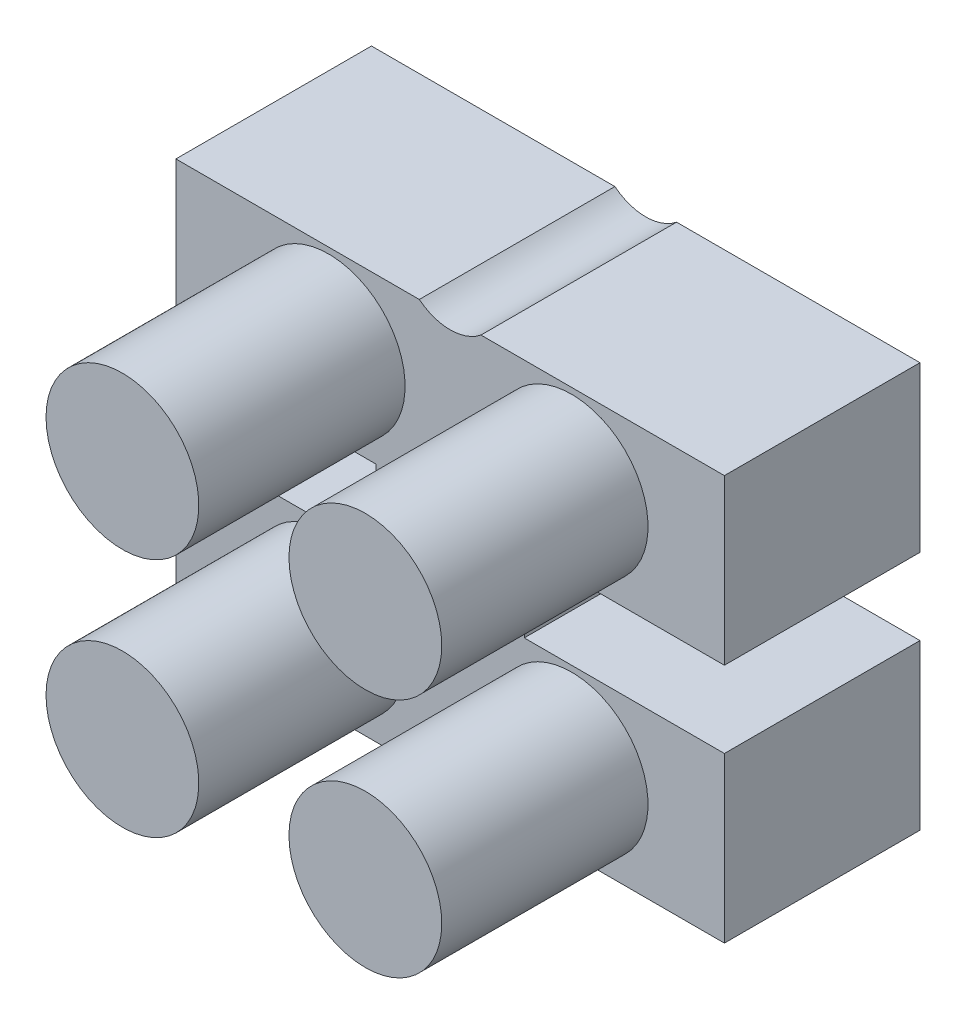
from build123d import *

# Parameters (mm, degrees)
SKETCH1_W                 = 18.2372
SKETCH1_H                 = 13.4874
BOSS_EXTRUDE1_DEPTH       = 6.5024
SKETCH2_W                 = 6.6548
SKETCH2_H                 = 2.54
CUT_EXTRUDE1_DEPTH        = 14.073161875
SKETCH5_R                 = 2.54
BOSS_EXTRUDE2_DEPTH       = 6.858
SKETCH6_W                 = 18.2372
SKETCH6_H                 = 5.4737
CUT_EXTRUDE2_DEPTH        = 14.253622888
F_4_CLEARANCE_HOLE1_D     = 3.2639
LPATTERN1_COUNT           = 4
LPATTERN1_PITCH           = 8.001
LPATTERN1_COPY_1_SKETCH_W = 6.6548
LPATTERN1_COPY_1_SKETCH_H = 2.54
LPATTERN1_COPY_1_DEPTH    = 14.073161875
LPATTERN1_COPY_2_SKETCH_W = 6.6548
LPATTERN1_COPY_2_SKETCH_H = 2.54
LPATTERN1_COPY_2_DEPTH    = 14.073161875
LPATTERN1_COPY_3_SKETCH_W = 6.6548
LPATTERN1_COPY_3_SKETCH_H = 2.54
LPATTERN1_COPY_3_DEPTH    = 14.073161875
LPATTERN1_COPY_4_SKETCH_R = 2.54
LPATTERN1_COPY_4_DEPTH    = 6.858
LPATTERN1_COPY_5_SKETCH_R = 2.54
LPATTERN1_COPY_5_DEPTH    = 6.858
LPATTERN1_COPY_6_SKETCH_R = 2.54
LPATTERN1_COPY_6_DEPTH    = 6.858
SKETCH7_W                 = 18.2372
SKETCH7_H                 = 8.0137
CUT_EXTRUDE3_DEPTH        = 33.795435519
SKETCH8_W                 = 18.2372
SKETCH8_H                 = 16.0147
CUT_EXTRUDE5_DEPTH        = 28.900509729


with BuildPart() as part:
    # Sketch1 → Boss-Extrude1 (new body)
    with BuildSketch(Plane.XY):
        Rectangle(SKETCH1_W, SKETCH1_H)
    boss_extrude1 = extrude(amount=BOSS_EXTRUDE1_DEPTH)

    # Sketch2 → Cut-Extrude1 (cut, through all)
    with BuildSketch(Plane.XY.offset(6.5024)):
        with Locations((5.7912, 0)):
            Rectangle(SKETCH2_W, SKETCH2_H)
    cut_extrude1 = extrude(amount=-CUT_EXTRUDE1_DEPTH, mode=Mode.SUBTRACT)

    # Sketch5 → Boss-Extrude2 (add)
    with BuildSketch(Plane.XY.offset(6.5024)):
        with Locations(Location((4.0386, -4.00685, 0), (0, 0, 180))):
            Circle(SKETCH5_R)
    boss_extrude2 = extrude(amount=BOSS_EXTRUDE2_DEPTH)

    # Sketch6 → Cut-Extrude2 (cut, through all)
    with BuildSketch(Plane.XY.offset(6.5024)):
        with Locations((0, 4.00685)):
            Rectangle(SKETCH6_W, SKETCH6_H)
    extrude(amount=-CUT_EXTRUDE2_DEPTH, mode=Mode.SUBTRACT)

    # #4 Clearance Hole1 (through all)
    with Locations(Plane.XY.offset(6.5024)):
        with Locations((0, 0)):
            f_4_clearance_hole1 = Hole(F_4_CLEARANCE_HOLE1_D / 2)

    # Mirror4: Cut-Extrude1, Boss-Extrude2 across plane
    add(cut_extrude1.mirror(Plane(origin=(0, 0, 0), x_dir=(0, 0, 1), z_dir=(1, 0, 0))), mode=Mode.SUBTRACT)
    add(boss_extrude2.mirror(Plane(origin=(0, 0, 0), x_dir=(0, 0, 1), z_dir=(1, 0, 0))))

    # LPattern1: Boss-Extrude1, Cut-Extrude1, Boss-Extrude2, #4 Clearance Hole1 ×4
    with Locations(*[(0, i * LPATTERN1_PITCH, 0) for i in range(1, LPATTERN1_COUNT)]):
        add(boss_extrude1)
        add(cut_extrude1, mode=Mode.SUBTRACT)
        add(boss_extrude2)
        add(f_4_clearance_hole1, mode=Mode.SUBTRACT)

    # LPattern1 copy 1 sketch → LPattern1 copy 1 (cut, through all)
    with BuildSketch(Plane(origin=(0, 8.001, 6.5024), x_dir=(-1, 0, 0), z_dir=(0, 0, 1))):
        with Locations((5.7912, 0)):
            Rectangle(LPATTERN1_COPY_1_SKETCH_W, LPATTERN1_COPY_1_SKETCH_H)
    extrude(amount=-LPATTERN1_COPY_1_DEPTH, mode=Mode.SUBTRACT)

    # LPattern1 copy 2 sketch → LPattern1 copy 2 (cut, through all)
    with BuildSketch(Plane(origin=(0, 16.002, 6.5024), x_dir=(-1, 0, 0), z_dir=(0, 0, 1))):
        with Locations((5.7912, 0)):
            Rectangle(LPATTERN1_COPY_2_SKETCH_W, LPATTERN1_COPY_2_SKETCH_H)
    extrude(amount=-LPATTERN1_COPY_2_DEPTH, mode=Mode.SUBTRACT)

    # LPattern1 copy 3 sketch → LPattern1 copy 3 (cut, through all)
    with BuildSketch(Plane(origin=(0, 24.003, 6.5024), x_dir=(-1, 0, 0), z_dir=(0, 0, 1))):
        with Locations((5.7912, 0)):
            Rectangle(LPATTERN1_COPY_3_SKETCH_W, LPATTERN1_COPY_3_SKETCH_H)
    extrude(amount=-LPATTERN1_COPY_3_DEPTH, mode=Mode.SUBTRACT)

    # LPattern1 copy 4 sketch → LPattern1 copy 4 (add)
    with BuildSketch(Plane(origin=(0, 8.001, 6.5024), x_dir=(-1, 0, 0), z_dir=(0, 0, 1))):
        with Locations((4.0386, 4.00685)):
            Circle(LPATTERN1_COPY_4_SKETCH_R)
    extrude(amount=LPATTERN1_COPY_4_DEPTH)

    # LPattern1 copy 5 sketch → LPattern1 copy 5 (add)
    with BuildSketch(Plane(origin=(0, 16.002, 6.5024), x_dir=(-1, 0, 0), z_dir=(0, 0, 1))):
        with Locations((4.0386, 4.00685)):
            Circle(LPATTERN1_COPY_5_SKETCH_R)
    extrude(amount=LPATTERN1_COPY_5_DEPTH)

    # LPattern1 copy 6 sketch → LPattern1 copy 6 (add)
    with BuildSketch(Plane(origin=(0, 24.003, 6.5024), x_dir=(-1, 0, 0), z_dir=(0, 0, 1))):
        with Locations((4.0386, 4.00685)):
            Circle(LPATTERN1_COPY_6_SKETCH_R)
    extrude(amount=LPATTERN1_COPY_6_DEPTH)

    # Sketch7 → Cut-Extrude3 (cut, through all)
    with BuildSketch(Plane.XY.offset(6.5024)):
        with Locations((0, 26.73985)):
            Rectangle(SKETCH7_W, SKETCH7_H)
    extrude(amount=-CUT_EXTRUDE3_DEPTH, mode=Mode.SUBTRACT)

    # Sketch8 → Cut-Extrude5 (cut, through all)
    with BuildSketch(Plane.XY):
        with Locations((0, 1.26365)):
            Rectangle(SKETCH8_W, SKETCH8_H)
    extrude(amount=CUT_EXTRUDE5_DEPTH, mode=Mode.SUBTRACT)


solid = part.part
